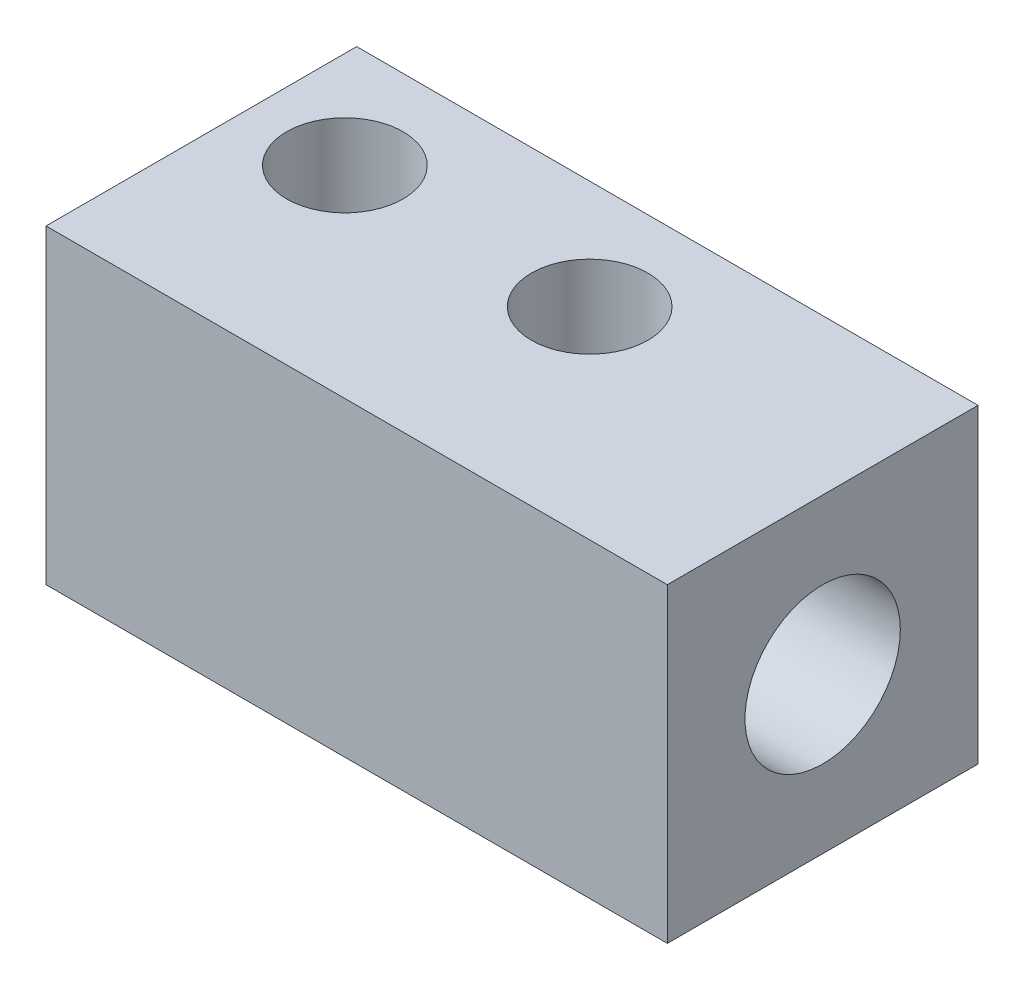
from build123d import *

# Parameters (mm, degrees)
SKETCH1_W                   = 25.4
SKETCH1_H                   = 12.7
BOSS_EXTRUDE1_DEPTH         = 6.35
F_3_16_0_1875_DOWEL_HOLE1_D = 4.7625
SKETCH6_R                   = 3.175
CUT_EXTRUDE1_DEPTH          = 6.35


with BuildPart() as part:
    # Sketch1 → Boss-Extrude1 (new, symmetric)
    with BuildSketch(Plane.XY):
        with Locations((12.7, 6.35)):
            Rectangle(SKETCH1_W, SKETCH1_H)
    extrude(amount=BOSS_EXTRUDE1_DEPTH, both=True)

    # 3/16 (0.1875) Dowel Hole1 (through all)
    with Locations(Plane(origin=(13.97, 12.7, -1.905), x_dir=(0, 0, 1), z_dir=(0, 1, 0))):
        with Locations((0, 0), (0, -10.0076)):
            Hole(F_3_16_0_1875_DOWEL_HOLE1_D / 2)

    # Sketch6 → Cut-Extrude1 (cut)
    with BuildSketch(Plane(origin=(25.4, 0, 0), x_dir=(0, 0, -1), z_dir=(1, 0, 0))):
        with Locations((0, 6.35)):
            Circle(SKETCH6_R)
    extrude(amount=-CUT_EXTRUDE1_DEPTH, mode=Mode.SUBTRACT)


solid = part.part
